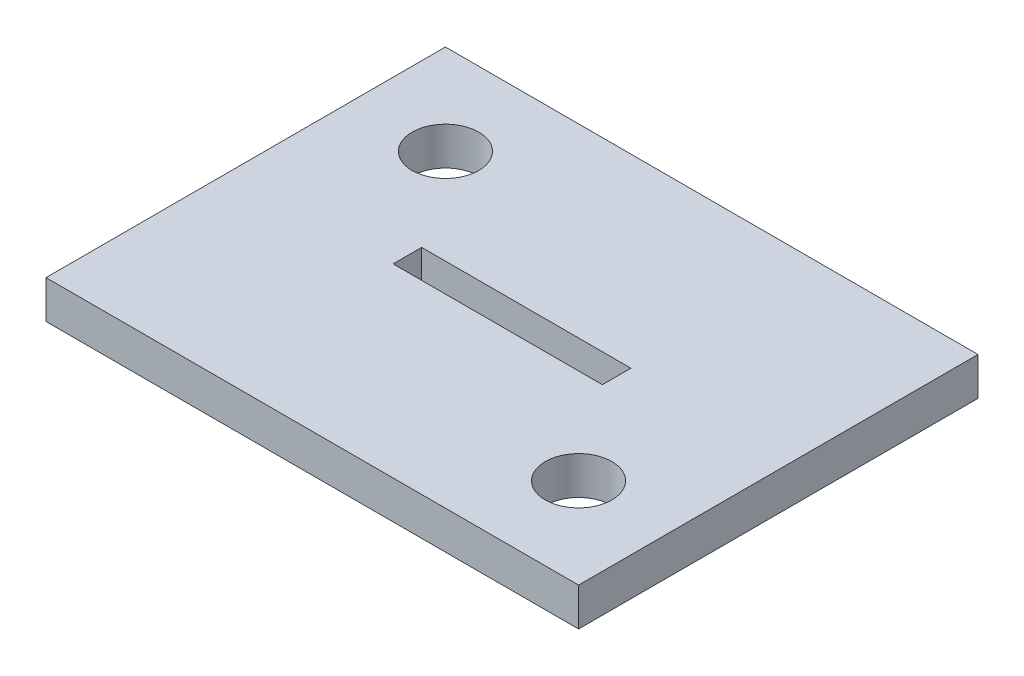
from build123d import *

# Parameters (mm, degrees)
SCHIZZO1_W                   = 28
SCHIZZO1_H                   = 21
SCHIZZO1_R                   = 1.75
SCHIZZO1_W_2                 = 11
SCHIZZO1_H_2                 = 1.5
ESTRUSIONE_ESTRUSIONE1_DEPTH = 2


with BuildPart() as part:
    # Schizzo1 → Estrusione-Estrusione1 (new body)
    with BuildSketch(Plane(origin=(0, 0, 0), x_dir=(1, 0, 0), z_dir=(0, 1, 0))):
        Rectangle(SCHIZZO1_W, SCHIZZO1_H)
        with Locations(Location((-9.25, 5.75, 0), (0, 0, 270))):
            Circle(SCHIZZO1_R, mode=Mode.SUBTRACT)
        with Locations(Location((9.25, -5.75, 0), (0, 0, 270))):
            Circle(SCHIZZO1_R, mode=Mode.SUBTRACT)
        Rectangle(SCHIZZO1_W_2, SCHIZZO1_H_2, mode=Mode.SUBTRACT)
    extrude(amount=ESTRUSIONE_ESTRUSIONE1_DEPTH)


solid = part.part
